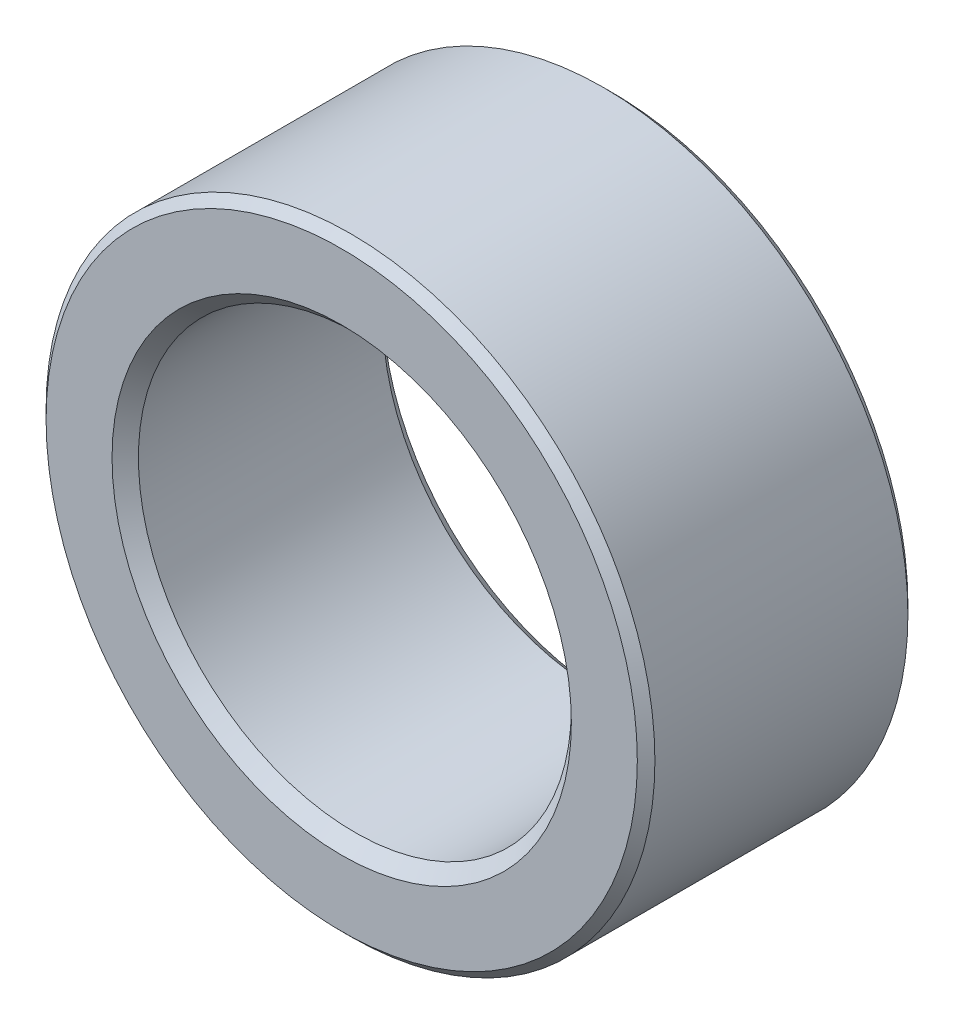
from build123d import *

# Parameters (mm, degrees)
BOSS_EXTRUDE1_DEPTH      = 1
BOSS_EXTRUDE1_DEPTH_BACK = 1
SKETCH3_R                = 2.25
SKETCH3_R_2              = 1.6
CHAMFER1_SIZE            = 0.065
CHAMFER2_SIZE            = 0.0975


with BuildPart() as part:
    # Sketch3 → Boss-Extrude1 (new, two sides: drawn at the far end of the back side and taken through both)
    with BuildSketch(Plane.XY.offset(-BOSS_EXTRUDE1_DEPTH_BACK)):
        Circle(SKETCH3_R)
        Circle(SKETCH3_R_2, mode=Mode.SUBTRACT)
    extrude(amount=BOSS_EXTRUDE1_DEPTH + BOSS_EXTRUDE1_DEPTH_BACK)

    # Chamfer1
    chamfer1_edges = [part.edges().sort_by_distance(p)[0] for p in [
        (-2.25, 0, -1),
        (-2.25, 0, 1),
    ]]
    chamfer(chamfer1_edges, length=CHAMFER1_SIZE)

    # Chamfer2
    chamfer2_edges = [part.edges().sort_by_distance(p)[0] for p in [
        (-1.6, 0, -1),
        (-1.6, 0, 1),
    ]]
    chamfer(chamfer2_edges, length=CHAMFER2_SIZE)


solid = part.part
